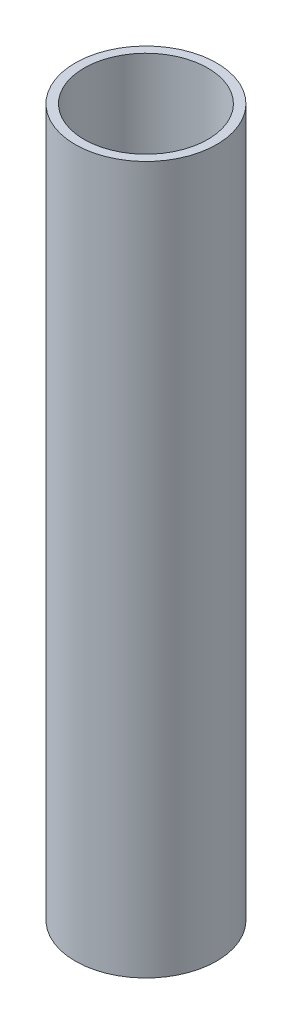
from build123d import *

# Parameters (mm, degrees)
SKETCH1_R           = 12
BOSS_EXTRUDE1_DEPTH = 120
SKETCH2_R           = 10.5
CUT_EXTRUDE1_DEPTH  = 20


with BuildPart() as part:
    # Sketch1 → Boss-Extrude1 (new body)
    with BuildSketch(Plane(origin=(0, 0, 0), x_dir=(1, 0, 0), z_dir=(0, 1, 0))):
        with Locations(Location((0, 0, 0), (0, 0, 270))):
            Circle(SKETCH1_R)
    extrude(amount=BOSS_EXTRUDE1_DEPTH)

    # Sketch2 → Cut-Extrude1 (cut)
    with BuildSketch(Plane(origin=(0, 120, 0), x_dir=(1, 0, 0), z_dir=(0, 1, 0))):
        with Locations(Location((0, 0, 0), (0, 0, 270))):
            Circle(SKETCH2_R)
    extrude(amount=-CUT_EXTRUDE1_DEPTH, mode=Mode.SUBTRACT)


solid = part.part
